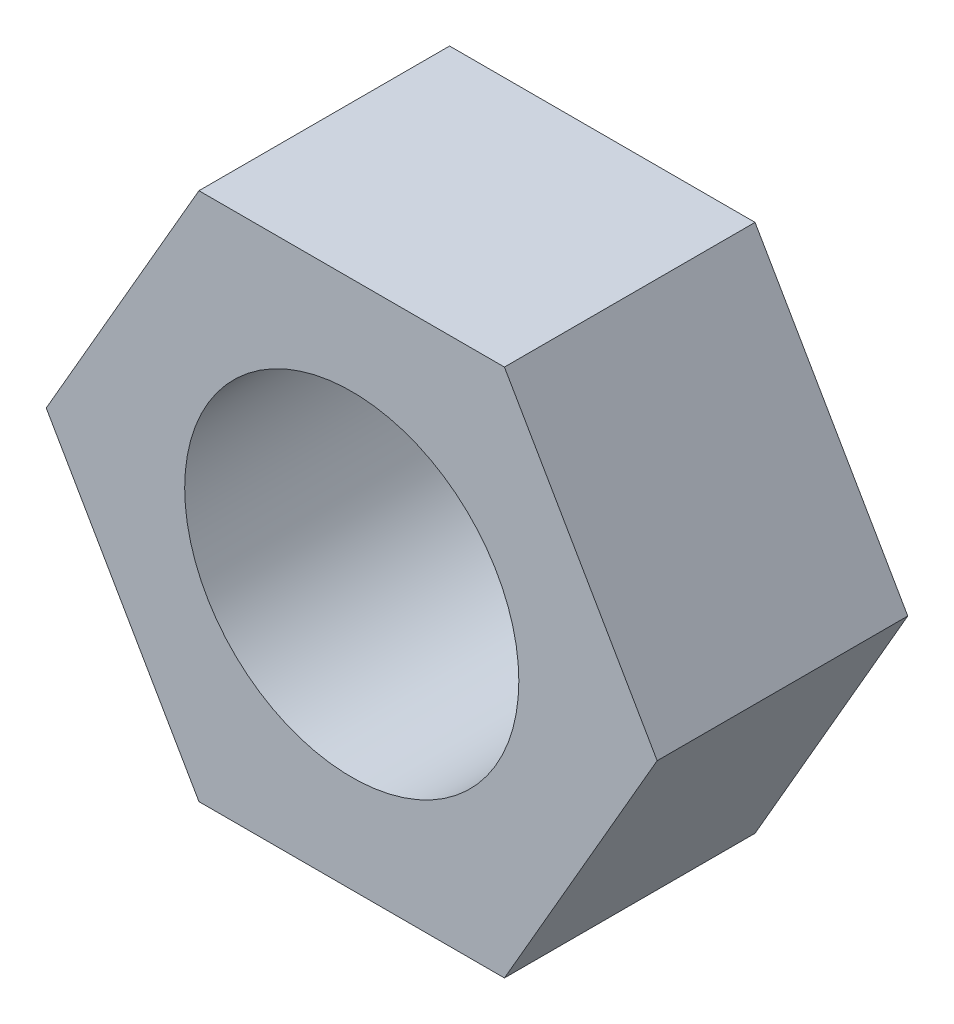
from build123d import *

# Parameters (mm, degrees)
EXTRUDE_1_DEPTH        = 9
M12X1_25_1_D           = 10.8
M12X1_25_1_DEPTH       = 27.75
M12X1_25_1_CBORE_D     = 12
M12X1_25_1_CBORE_DEPTH = 24
M12X1_25_1_TIP         = 3.244647343


with BuildPart() as part:
    # 草图1 → 拉伸1 (new body)
    with BuildSketch(Plane.XY):
        Polygon((-5.484827557, 9.5), (5.484827557, 9.5), (10.969655115, 0), (5.484827557, -9.5), (-5.484827557, -9.5), (-10.969655115, 0), align=None)
    extrude(amount=EXTRUDE_1_DEPTH)

    # M12x1.25 螺纹孔1
    with Locations(Plane(origin=(0.002521047, 0, 9), x_dir=(1, 0, 0), z_dir=(0, 0, 1))):
        with Locations((0, 0)):
            CounterBoreHole(M12X1_25_1_D / 2, M12X1_25_1_CBORE_D / 2, M12X1_25_1_CBORE_DEPTH, depth=M12X1_25_1_DEPTH)
            with Locations((0, 0, -(M12X1_25_1_DEPTH + M12X1_25_1_TIP / 2))):  # 118° drill point
                Cone(0, M12X1_25_1_D / 2, M12X1_25_1_TIP, mode=Mode.SUBTRACT)


solid = part.part
